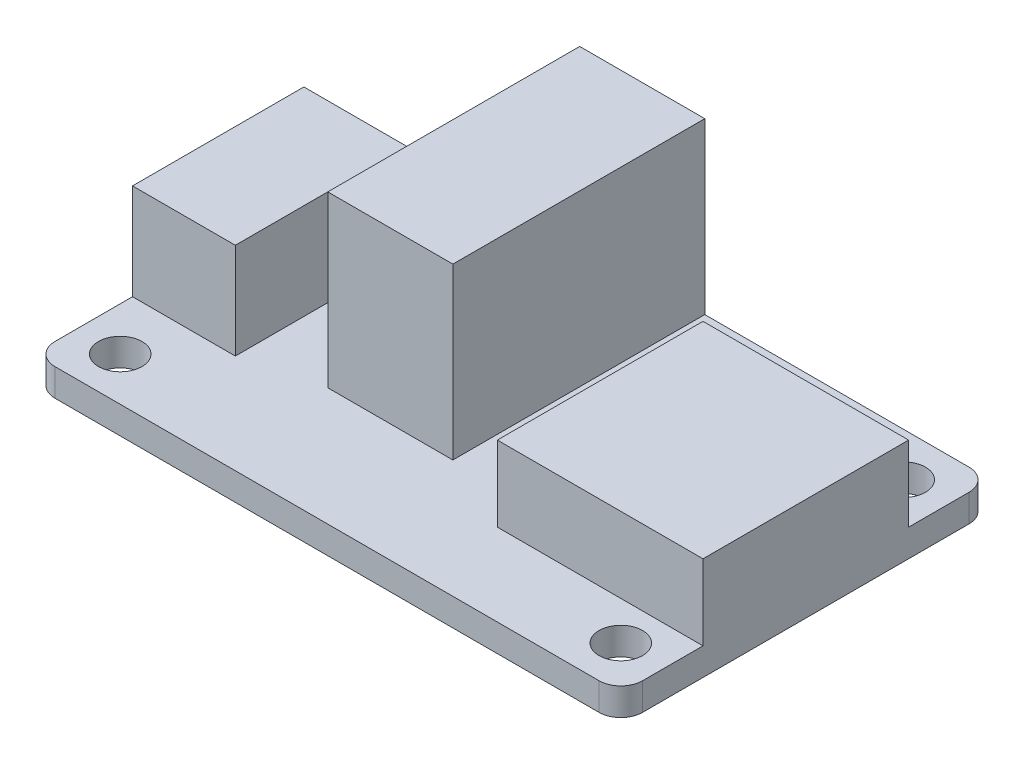
from build123d import *

# Parameters (mm, degrees)
SKETCH2_W                 = 34.29
SKETCH2_H                 = 21.59
SKETCH2_R                 = 1.27
PCB_DEPTH                 = 1.6
FILLET1_R                 = 1.27
SKETCH3_W                 = 6
SKETCH3_H                 = 10
CONTROL_CONNECTOR_DEPTH   = 5.6
SKETCH3_3_W               = 12
SKETCH3_3_H               = 12
ELECTRODE_CONNECTOR_DEPTH = 4.4
SKETCH3_4_W               = 7.3
SKETCH3_4_H               = 14.7
RELAY_DEPTH               = 9.9


with BuildPart() as part:
    # Sketch2 → PCB (new body)
    with BuildSketch(Plane(origin=(0, 0, 0), x_dir=(1, 0, 0), z_dir=(0, 1, 0))):
        Rectangle(SKETCH2_W, SKETCH2_H)
        with Locations((-14.605, 8.255)):
            Circle(SKETCH2_R, mode=Mode.SUBTRACT)
        with Locations((14.605, 8.255)):
            Circle(SKETCH2_R, mode=Mode.SUBTRACT)
        with Locations((14.605, -8.255)):
            Circle(SKETCH2_R, mode=Mode.SUBTRACT)
        with Locations((-14.605, -8.255)):
            Circle(SKETCH2_R, mode=Mode.SUBTRACT)
    extrude(amount=PCB_DEPTH)

    # Fillet1
    fillet1_edges = [part.edges().sort_by_distance(p)[0] for p in [
        (-17.145, 0.8, -10.795),
        (17.145, 0.8, -10.795),
        (17.145, 0.8, 10.795),
        (-17.145, 0.8, 10.795),
    ]]
    fillet(fillet1_edges, radius=FILLET1_R)

    # Sketch3 → Control_connector (add)
    with BuildSketch(Plane(origin=(0, 1.6, 0), x_dir=(1, 0, 0), z_dir=(0, 1, 0))):
        with Locations((-14.145, 0)):
            Rectangle(SKETCH3_W, SKETCH3_H)
    extrude(amount=CONTROL_CONNECTOR_DEPTH)

    # Sketch3<3> → Electrode_connector (add)
    with BuildSketch(Plane(origin=(0, 1.6, 0), x_dir=(1, 0, 0), z_dir=(0, 1, 0))):
        with Locations((11.145, 0)):
            Rectangle(SKETCH3_3_W, SKETCH3_3_H)
    extrude(amount=ELECTRODE_CONNECTOR_DEPTH)

    # Sketch3<4> → Relay (add)
    with BuildSketch(Plane(origin=(0, 1.6, 0), x_dir=(1, 0, 0), z_dir=(0, 1, 0))):
        with Locations((-3.195, 3.445)):
            Rectangle(SKETCH3_4_W, SKETCH3_4_H)
    extrude(amount=RELAY_DEPTH)


solid = part.part
